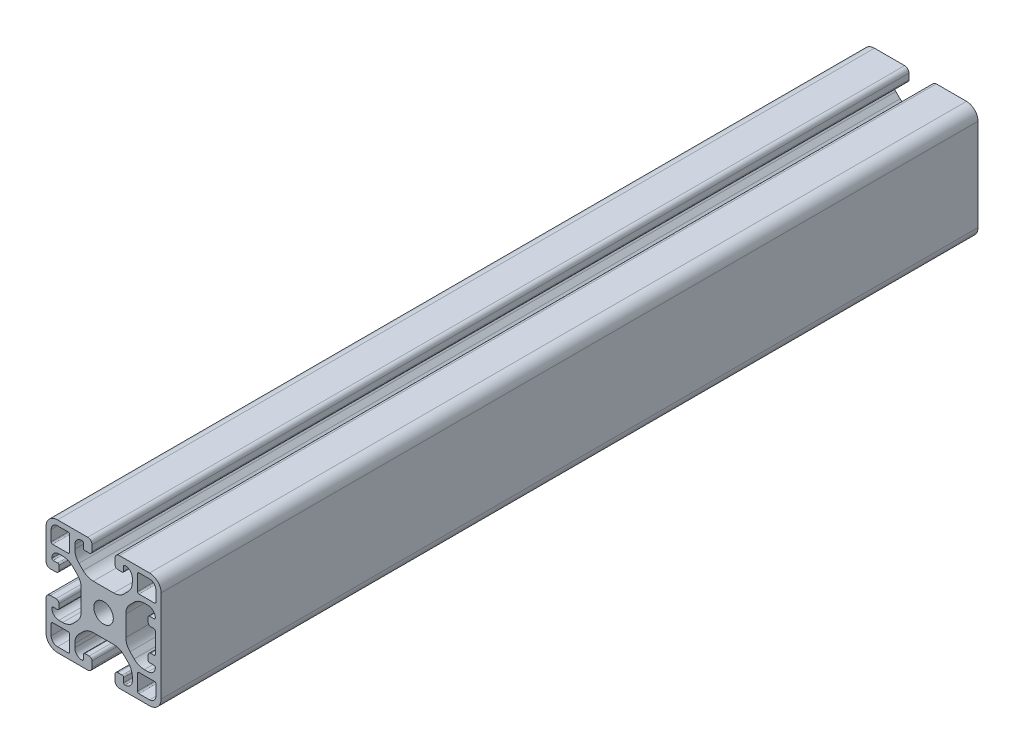
from build123d import *

# Parameters (mm, degrees)
SCHIZZO1_R                   = 3.4
ESTRUSIONE_ESTRUSIONE1_DEPTH = 284


with BuildPart() as part:
    # Schizzo1 → Estrusione-Estrusione1 (new body)
    with BuildSketch(Plane(origin=(0, 0, -340), x_dir=(-1, 0, 0), z_dir=(0, 0, -1))):
        with BuildLine():
            Line((6.5, -15.5), (5, -15.5))
            ThreePointArc((5, -15.5), (4.292893219, -15.792893219), (4, -16.5))
            Line((4, -16.5), (4, -18.5))
            ThreePointArc((4, -18.5), (4.439339828, -19.560660172), (5.5, -20))
            Line((5.5, -20), (16, -20))
            ThreePointArc((16, -20), (18.828427125, -18.828427125), (20, -16))
            Line((20, -16), (20, -5.5))
            ThreePointArc((20, -5.5), (19.560660172, -4.439339828), (18.5, -4))
            Line((18.5, -4), (16.5, -4))
            ThreePointArc((16.5, -4), (15.792893219, -4.292893219), (15.5, -5))
            Line((15.5, -5), (15.5, -6.5))
            ThreePointArc((15.5, -6.5), (15.646446609, -6.853553391), (16, -7))
            Line((16, -7), (17.55, -7))
            ThreePointArc((17.55, -7), (17.868198052, -7.131801948), (18, -7.45))
            Line((18, -7.45), (18, -7.5))
            ThreePointArc((18, -7.5), (17.267766953, -9.267766953), (15.5, -10))
            Line((15.5, -10), (14.192388155, -10))
            ThreePointArc((14.192388155, -10), (12.278970994, -9.619397663), (10.656854249, -8.535533906))
            Line((10.656854249, -8.535533906), (9.214466094, -7.09314575))
            ThreePointArc((9.214466094, -7.09314575), (8.130602337, -5.471029006), (7.75, -3.557611845))
            Line((7.75, -3.557611845), (7.75, 3.557611845))
            ThreePointArc((7.75, 3.557611845), (8.130602337, 5.471029006), (9.214466094, 7.09314575))
            Line((9.214466094, 7.09314575), (10.656854249, 8.535533906))
            ThreePointArc((10.656854249, 8.535533906), (12.278970994, 9.619397663), (14.192388155, 10))
            Line((14.192388155, 10), (15.5, 10))
            ThreePointArc((15.5, 10), (17.267766953, 9.267766953), (18, 7.5))
            Line((18, 7.5), (18, 7.45))
            ThreePointArc((18, 7.45), (17.868198052, 7.131801948), (17.55, 7))
            Line((17.55, 7), (16, 7))
            ThreePointArc((16, 7), (15.646446609, 6.853553391), (15.5, 6.5))
            Line((15.5, 6.5), (15.5, 5))
            ThreePointArc((15.5, 5), (15.792893219, 4.292893219), (16.5, 4))
            Line((16.5, 4), (18.5, 4))
            ThreePointArc((18.5, 4), (19.560660172, 4.439339828), (20, 5.5))
            Line((20, 5.5), (20, 16))
            ThreePointArc((20, 16), (18.828427125, 18.828427125), (16, 20))
            Line((16, 20), (5.5, 20))
            ThreePointArc((5.5, 20), (4.439339828, 19.560660172), (4, 18.5))
            Line((4, 18.5), (4, 16.5))
            ThreePointArc((4, 16.5), (4.292893219, 15.792893219), (5, 15.5))
            Line((5, 15.5), (6.5, 15.5))
            ThreePointArc((6.5, 15.5), (6.853553391, 15.646446609), (7, 16))
            Line((7, 16), (7, 17.55))
            ThreePointArc((7, 17.55), (7.131801948, 17.868198052), (7.45, 18))
            Line((7.45, 18), (7.5, 18))
            ThreePointArc((7.5, 18), (9.267766953, 17.267766953), (10, 15.5))
            Line((10, 15.5), (10, 14.192388155))
            ThreePointArc((10, 14.192388155), (9.619397663, 12.278970994), (8.535533906, 10.656854249))
            Line((8.535533906, 10.656854249), (7.09314575, 9.214466094))
            ThreePointArc((7.09314575, 9.214466094), (5.471029006, 8.130602337), (3.557611844, 7.75))
            Line((3.557611844, 7.75), (-3.557611845, 7.75))
            ThreePointArc((-3.557611845, 7.75), (-5.471029006, 8.130602337), (-7.09314575, 9.214466094))
            Line((-7.09314575, 9.214466094), (-8.535533906, 10.656854249))
            ThreePointArc((-8.535533906, 10.656854249), (-9.619397663, 12.278970994), (-10, 14.192388155))
            Line((-10, 14.192388155), (-10, 15.5))
            ThreePointArc((-10, 15.5), (-9.267766953, 17.267766953), (-7.5, 18))
            Line((-7.5, 18), (-7.45, 18))
            ThreePointArc((-7.45, 18), (-7.131801948, 17.868198052), (-7, 17.55))
            Line((-7, 17.55), (-7, 16))
            ThreePointArc((-7, 16), (-6.853553391, 15.646446609), (-6.5, 15.5))
            Line((-6.5, 15.5), (-5, 15.5))
            ThreePointArc((-5, 15.5), (-4.292893219, 15.792893219), (-4, 16.5))
            Line((-4, 16.5), (-4, 18.5))
            ThreePointArc((-4, 18.5), (-4.439339828, 19.560660172), (-5.5, 20))
            Line((-5.5, 20), (-16, 20))
            ThreePointArc((-16, 20), (-18.828427125, 18.828427125), (-20, 16))
            Line((-20, 16), (-20, -16))
            ThreePointArc((-20, -16), (-18.828427125, -18.828427125), (-16, -20))
            Line((-16, -20), (-5.5, -20))
            ThreePointArc((-5.5, -20), (-4.439339828, -19.560660172), (-4, -18.5))
            Line((-4, -18.5), (-4, -16.5))
            ThreePointArc((-4, -16.5), (-4.292893219, -15.792893219), (-5, -15.5))
            Line((-5, -15.5), (-6.5, -15.5))
            ThreePointArc((-6.5, -15.5), (-6.853553391, -15.646446609), (-7, -16))
            Line((-7, -16), (-7, -17.55))
            ThreePointArc((-7, -17.55), (-7.131801948, -17.868198052), (-7.45, -18))
            Line((-7.45, -18), (-7.5, -18))
            ThreePointArc((-7.5, -18), (-9.267766953, -17.267766953), (-10, -15.5))
            Line((-10, -15.5), (-10, -14.192388155))
            ThreePointArc((-10, -14.192388155), (-9.619397663, -12.278970994), (-8.535533906, -10.656854249))
            Line((-8.535533906, -10.656854249), (-7.09314575, -9.214466094))
            ThreePointArc((-7.09314575, -9.214466094), (-5.471029006, -8.130602337), (-3.557611845, -7.75))
            Line((-3.557611845, -7.75), (3.557611845, -7.75))
            ThreePointArc((3.557611845, -7.75), (5.471029006, -8.130602337), (7.09314575, -9.214466094))
            Line((7.09314575, -9.214466094), (8.535533906, -10.656854249))
            ThreePointArc((8.535533906, -10.656854249), (9.619397663, -12.278970994), (10, -14.192388155))
            Line((10, -14.192388155), (10, -15.5))
            ThreePointArc((10, -15.5), (9.267766953, -17.267766953), (7.5, -18))
            Line((7.5, -18), (7.45, -18))
            ThreePointArc((7.45, -18), (7.131801948, -17.868198052), (7, -17.55))
            Line((7, -17.55), (7, -16))
            ThreePointArc((7, -16), (6.853553391, -15.646446609), (6.5, -15.5))
        make_face()
        with Locations(Location((0, 0, 0), (0, 0, 180))):
            Circle(SCHIZZO1_R, mode=Mode.SUBTRACT)
        with BuildLine():
            Line((-12.3, -18.2), (-16, -18.2))
            ThreePointArc((-16, -18.2), (-17.555634919, -17.555634919), (-18.2, -16))
            Line((-18.2, -16), (-18.2, -12.3))
            ThreePointArc((-18.2, -12.3), (-18.053553391, -11.946446609), (-17.7, -11.8))
            Line((-17.7, -11.8), (-12.3, -11.8))
            ThreePointArc((-12.3, -11.8), (-11.946446609, -11.946446609), (-11.8, -12.3))
            Line((-11.8, -12.3), (-11.8, -17.7))
            ThreePointArc((-11.8, -17.7), (-11.946446609, -18.053553391), (-12.3, -18.2))
        make_face(mode=Mode.SUBTRACT)
        with BuildLine():
            Line((-11.8, 17.7), (-11.8, 12.3))
            ThreePointArc((-11.8, 12.3), (-11.946446609, 11.946446609), (-12.3, 11.8))
            Line((-12.3, 11.8), (-17.7, 11.8))
            ThreePointArc((-17.7, 11.8), (-18.053553391, 11.946446609), (-18.2, 12.3))
            Line((-18.2, 12.3), (-18.2, 16))
            ThreePointArc((-18.2, 16), (-17.555634919, 17.555634919), (-16, 18.2))
            Line((-16, 18.2), (-12.3, 18.2))
            ThreePointArc((-12.3, 18.2), (-11.946446609, 18.053553391), (-11.8, 17.7))
        make_face(mode=Mode.SUBTRACT)
        with BuildLine():
            Line((18.2, 16), (18.2, 12.3))
            ThreePointArc((18.2, 12.3), (18.053553391, 11.946446609), (17.7, 11.8))
            Line((17.7, 11.8), (12.3, 11.8))
            ThreePointArc((12.3, 11.8), (11.946446609, 11.946446609), (11.8, 12.3))
            Line((11.8, 12.3), (11.8, 17.7))
            ThreePointArc((11.8, 17.7), (11.946446609, 18.053553391), (12.3, 18.2))
            Line((12.3, 18.2), (16, 18.2))
            ThreePointArc((16, 18.2), (17.555634919, 17.555634919), (18.2, 16))
        make_face(mode=Mode.SUBTRACT)
        with BuildLine():
            Line((18.2, -12.3), (18.2, -16))
            ThreePointArc((18.2, -16), (17.555634919, -17.555634919), (16, -18.2))
            Line((16, -18.2), (12.3, -18.2))
            ThreePointArc((12.3, -18.2), (11.946446609, -18.053553391), (11.8, -17.7))
            Line((11.8, -17.7), (11.8, -12.3))
            ThreePointArc((11.8, -12.3), (11.946446609, -11.946446609), (12.3, -11.8))
            Line((12.3, -11.8), (17.7, -11.8))
            ThreePointArc((17.7, -11.8), (18.053553391, -11.946446609), (18.2, -12.3))
        make_face(mode=Mode.SUBTRACT)
        with BuildLine():
            Line((-16, 7), (-17.5, 7))
            ThreePointArc((-17.5, 7), (-17.853553391, 7.146446609), (-18, 7.5))
            ThreePointArc((-18, 7.5), (-17.267766953, 9.267766953), (-15.5, 10))
            Line((-15.5, 10), (-14.192388155, 10))
            ThreePointArc((-14.192388155, 10), (-12.278970994, 9.619397663), (-10.656854249, 8.535533906))
            Line((-10.656854249, 8.535533906), (-9.214466094, 7.093145751))
            ThreePointArc((-9.214466094, 7.093145751), (-8.130602337, 5.471029006), (-7.75, 3.557611845))
            Line((-7.75, 3.557611845), (-7.75, -3.557611845))
            ThreePointArc((-7.75, -3.557611845), (-8.130602337, -5.471029006), (-9.214466094, -7.093145751))
            Line((-9.214466094, -7.093145751), (-10.656854249, -8.535533906))
            ThreePointArc((-10.656854249, -8.535533906), (-12.278970994, -9.619397663), (-14.192388155, -10))
            Line((-14.192388155, -10), (-15.5, -10))
            ThreePointArc((-15.5, -10), (-17.267766953, -9.267766953), (-18, -7.5))
            ThreePointArc((-18, -7.5), (-17.853553391, -7.146446609), (-17.5, -7))
            Line((-17.5, -7), (-16, -7))
            ThreePointArc((-16, -7), (-15.646446609, -6.853553391), (-15.5, -6.5))
            Line((-15.5, -6.5), (-15.5, -5))
            ThreePointArc((-15.5, -5), (-15.792893219, -4.292893219), (-16.5, -4))
            Line((-16.5, -4), (-17.5, -4))
            ThreePointArc((-17.5, -4), (-17.853553391, -3.853553391), (-18, -3.5))
            Line((-18, -3.5), (-18, 3.5))
            ThreePointArc((-18, 3.5), (-17.853553391, 3.853553391), (-17.5, 4))
            Line((-17.5, 4), (-16.5, 4))
            ThreePointArc((-16.5, 4), (-15.792893219, 4.292893219), (-15.5, 5))
            Line((-15.5, 5), (-15.5, 6.5))
            ThreePointArc((-15.5, 6.5), (-15.646446609, 6.853553391), (-16, 7))
        make_face(mode=Mode.SUBTRACT)
    extrude(amount=-ESTRUSIONE_ESTRUSIONE1_DEPTH)


solid = part.part
